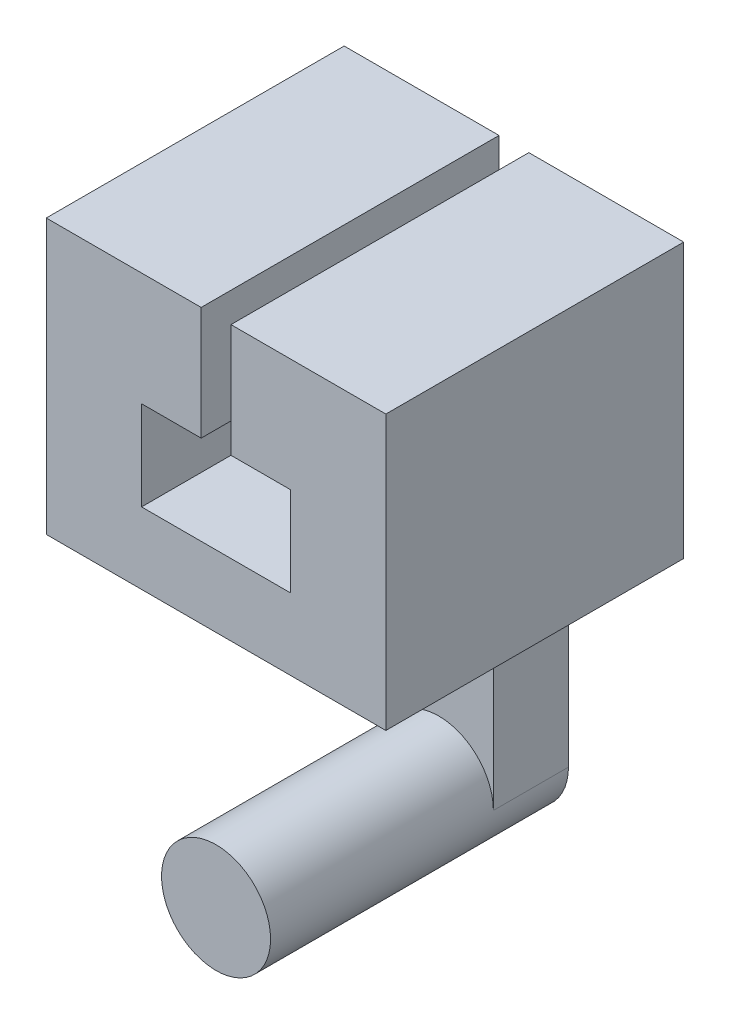
from build123d import *

# Parameters (mm, degrees)
SKETCH1_R    = 23.241
FTA_DEPTH    = 127
SKETCH2_W    = 46.482
SKETCH2_H    = 101.6
FTB_DEPTH    = 32.004
FTC_DEPTH    = 127
SKETCH4_W    = 40.64
SKETCH4_H    = 38.1
FTD1_DEPTH   = 127
SKETCH4_5_W  = 40.64
SKETCH4_5_H  = 38.1
FTD2_DEPTH   = 127
SKETCH5_W    = 25.4
SKETCH5_H    = 48.26
FTE_DEPTH    = 127
FTE_2_DEPTH  = 127
SKETCH6_W    = 40.64
SKETCH6_H    = 48.26
SKETCH6_H_2  = 30.48
FILLER_DEPTH = 127


with BuildPart() as part:
    # Sketch1 → ftA (new body)
    with BuildSketch(Plane.XY):
        Circle(SKETCH1_R)
    extrude(amount=-FTA_DEPTH)


with BuildPart() as body_2:
    # Sketch2 → ftB (new body)
    with BuildSketch(Plane(origin=(0, 0, -127), x_dir=(-1, 0, 0), z_dir=(0, 0, -1))):
        with Locations((0, 50.8)):
            Rectangle(SKETCH2_W, SKETCH2_H)
    extrude(amount=-FTB_DEPTH)

    # Sketch3 → ftC (add)
    with BuildSketch(Plane(origin=(0, 0, -127), x_dir=(-1, 0, 0), z_dir=(0, 0, -1))):
        Polygon((-23.241, 101.6), (-31.75, 101.6), (-31.75, 132.08), (31.75, 132.08), (31.75, 101.6), (23.241, 101.6), align=None)
    extrude(amount=-FTC_DEPTH)



with BuildPart() as body_3:
    # Sketch4 → ftD1 (new body)
    with BuildSketch(Plane.XY):
        with Locations((52.07, 151.13)):
            Rectangle(SKETCH4_W, SKETCH4_H)
    extrude(amount=-FTD1_DEPTH)

    # Sketch4<5> → ftD2 (add)
    with BuildSketch(Plane.XY):
        with Locations((-52.07, 151.13)):
            Rectangle(SKETCH4_5_W, SKETCH4_5_H)
        with Locations((52.07, 151.13)):
            Rectangle(SKETCH4_5_W, SKETCH4_5_H)
    extrude(amount=-FTD2_DEPTH)


with BuildPart() as ftd2_piece_1:
    # of the separate pieces the step leaves, piece 1, a body of its own (ftd2_pieces)
    add(body_3.part.solids().sort_by_distance((31.75, 132.08, 0))[0])


with BuildPart() as ftd2_piece_2:
    # of the separate pieces the step leaves, piece 2, a body of its own (ftd2_pieces)
    add(body_3.part.solids().sort_by_distance((-31.75, 132.08, 0))[0])


with BuildPart() as body_5:
    # Sketch5 → ftE (new body)
    with BuildSketch(Plane.XY):
        with Locations((-19.05, 194.31)):
            Rectangle(SKETCH5_W, SKETCH5_H)
    extrude(amount=-FTE_DEPTH)


with BuildPart() as body_6:
    # Sketch5 → ftE 2 (new body)
    with BuildSketch(Plane.XY):
        with Locations((19.05, 194.31)):
            Rectangle(SKETCH5_W, SKETCH5_H)
    extrude(amount=-FTE_2_DEPTH)


with BuildPart() as body_2_1:
    add(body_2.part)

    add(ftd2_piece_1.part)  # Filler merges ftD2 piece 1

    add(ftd2_piece_2.part)  # Filler merges ftD2 piece 2

    add(body_5.part)  # Filler merges body 5

    add(body_6.part)  # Filler merges body 6
    # Sketch6 → Filler (add)
    with BuildSketch(Plane.XY):
        with Locations((52.07, 194.31)):
            Rectangle(SKETCH6_W, SKETCH6_H)
        with Locations((-52.07, 194.31)):
            Rectangle(SKETCH6_W, SKETCH6_H)
        with Locations((-52.07, 116.84)):
            Rectangle(SKETCH6_W, SKETCH6_H_2)
        with Locations((52.07, 116.84)):
            Rectangle(SKETCH6_W, SKETCH6_H_2)
    extrude(amount=-FILLER_DEPTH)


solid = Compound([part.part, body_2_1.part])
